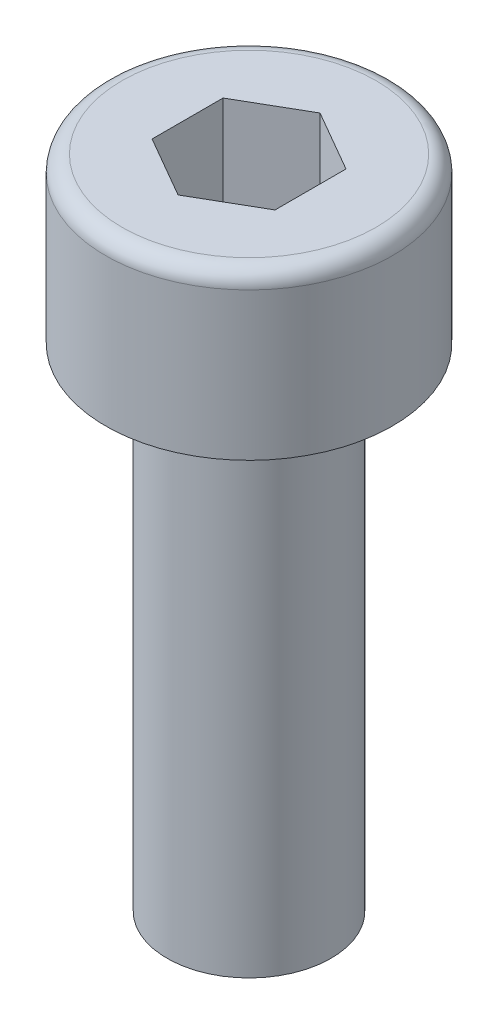
from build123d import *

# Parameters (mm, degrees)
CUT_EXTRUDE1_DEPTH = 3


with BuildPart() as part:
    # Sketch1 → Revolve1 (revolve)
    with BuildSketch(Plane.XY, mode=Mode.PRIVATE) as revolve1_sk:
        with BuildLine():
            Line((0, 16), (-3.1, 16))
            ThreePointArc((-3.1, 16), (-3.382842712, 15.882842712), (-3.5, 15.6))
            Line((-3.5, 15.6), (-3.5, 12))
            Line((-3.5, 12), (-2, 12))
            Line((-2, 12), (-2, 0))
            Line((-2, 0), (0, 0))
            Line((0, 0), (0, 16))
        make_face()
    revolve(revolve1_sk.sketch.rotate(Axis((0, 0, 0), (0, 1, 0)), 270), axis=Axis((0, 0, 0), (0, 1, 0)))

    # Sketch2 → Cut-Extrude1 (cut)
    with BuildSketch(Plane(origin=(0, 16, 0), x_dir=(1, 0, 0), z_dir=(0, 1, 0))):
        Polygon((0, 1.732050808), (-1.5, 0.866025404), (-1.5, -0.866025404), (0, -1.732050808), (1.5, -0.866025404), (1.5, 0.866025404), align=None)
    extrude(amount=-CUT_EXTRUDE1_DEPTH, mode=Mode.SUBTRACT)


solid = part.part
